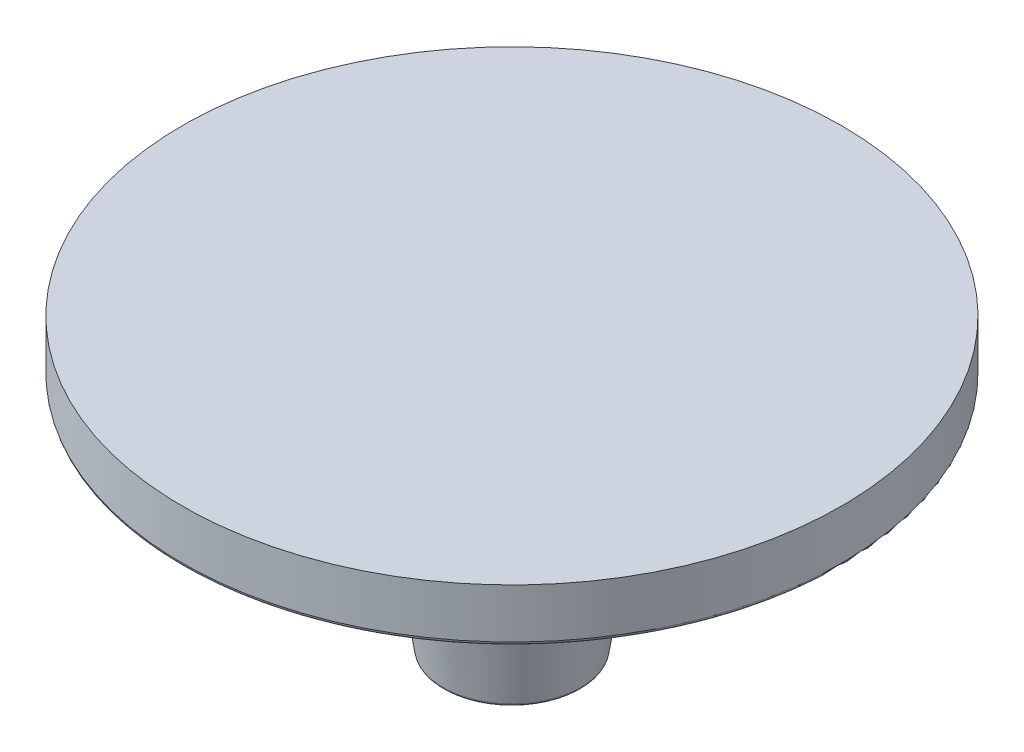
from build123d import *


with BuildPart() as part:
    # Sketch2 → Revolve1 (revolve)
    with BuildSketch(Plane.XY, mode=Mode.PRIVATE) as revolve1_sk:
        with BuildLine():
            Line((3.228608948, 12.093901983), (2.421391052, 20.640914998))
            ThreePointArc((2.421391052, 20.640914998), (2.340759387, 20.802309311), (2.172498617, 20.86740849))
            Line((2.172498617, 20.86740849), (0, 20.86740849))
            Line((0, 20.86740849), (0, 33.86740849))
            Line((0, 33.86740849), (25, 33.86740849))
            Line((25, 33.86740849), (25, 30.11740849))
            ThreePointArc((25, 30.11740849), (24.926776695, 29.940631795), (24.75, 29.86740849))
            Line((24.75, 29.86740849), (23.25, 29.86740849))
            ThreePointArc((23.25, 29.86740849), (23.073223305, 29.940631795), (23, 30.11740849))
            Line((23, 30.11740849), (23, 30.61740849))
            ThreePointArc((23, 30.61740849), (22.926776695, 30.794185186), (22.75, 30.86740849))
            Line((22.75, 30.86740849), (8.247262678, 30.86740849))
            ThreePointArc((8.247262678, 30.86740849), (8.084050398, 30.806780483), (8, 30.654302503))
            Line((8, 30.654302503), (5.228608948, 12.080514478))
            ThreePointArc((5.228608948, 12.080514478), (5.14455855, 11.928036498), (4.98134627, 11.86740849))
            Line((4.98134627, 11.86740849), (3.477501383, 11.86740849))
            ThreePointArc((3.477501383, 11.86740849), (3.309240613, 11.93250767), (3.228608948, 12.093901983))
        make_face()
    revolve(revolve1_sk.sketch.rotate(Axis((0, 20.86740849, 0), (0, 1, 0)), 90), axis=Axis((0, 20.86740849, 0), (0, 1, 0)))


solid = part.part
